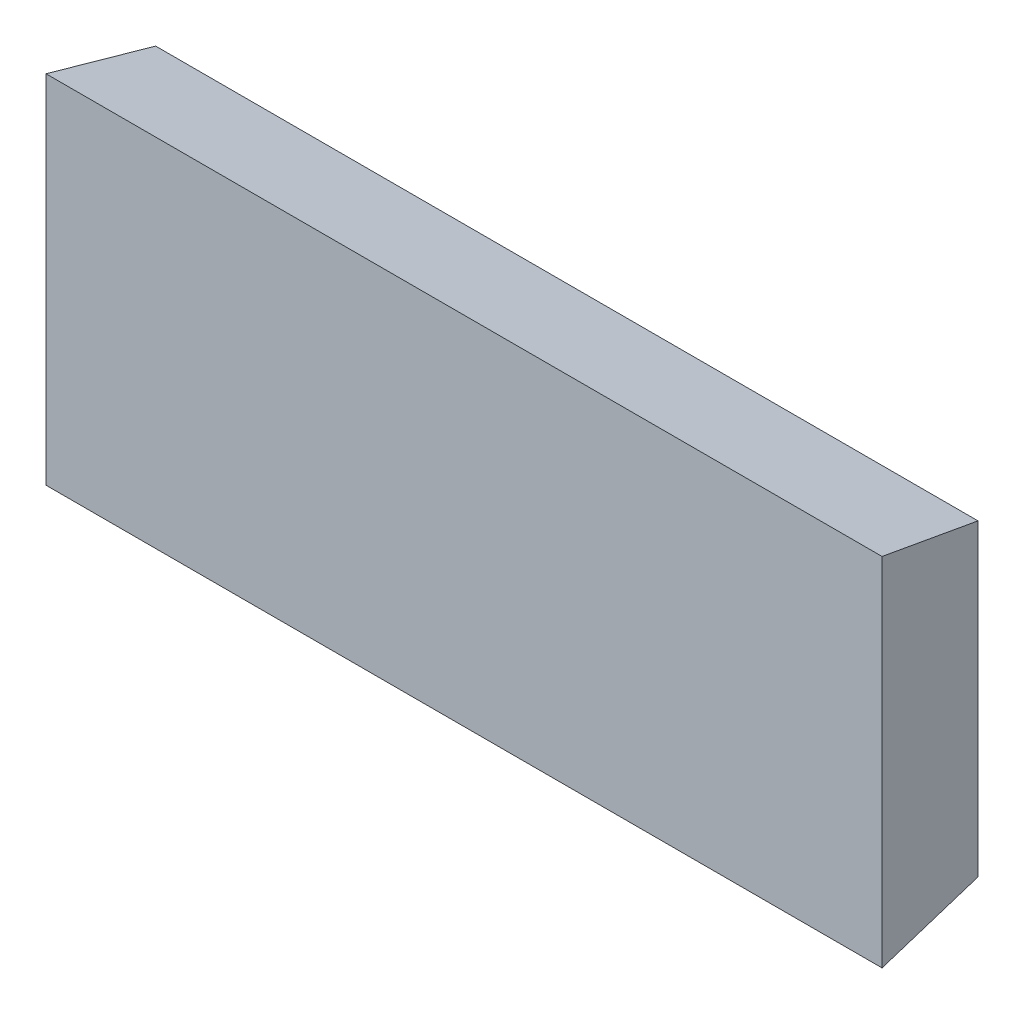
from build123d import *

# Parameters (mm, degrees)
BOSS_EXTRUDE1_DEPTH             = 80
BOSS_EXTRUDE2_REACH             = 88.865
BOSS_EXTRUDE2_DIRECTION_2_REACH = 88.865


with BuildPart() as part:
    # Sketch2 → Boss-Extrude1 (new body)
    with BuildSketch(Plane(origin=(0, 0, 0), x_dir=(0, 0, -1), z_dir=(1, 0, 0))):
        Polygon((0, 30), (-10, 32.333333333), (-10, -2.333333333), (0, 0), align=None)
    extrude(amount=BOSS_EXTRUDE1_DEPTH)

    # Boss-Extrude2: up to this face of the body (flat: up to its plane)
    boss_extrude2_end = Plane(part.part.faces().sort_by_distance((40, 31.166666667, 5))[0])
    # Sketch4 → Boss-Extrude2 (add, up to the picked face)
    with BuildSketch(Plane(origin=(0, 0, 0), x_dir=(1, 0, 0), z_dir=(0, 1, 0)), mode=Mode.PRIVATE) as boss_extrude2_sk1:
        Polygon((0, 0), (0, -10), (-0.666666667, -10), align=None)
    boss_extrude2_tool1 = split(extrude(boss_extrude2_sk1.sketch, amount=BOSS_EXTRUDE2_REACH, mode=Mode.PRIVATE), bisect_by=boss_extrude2_end, keep=Keep.BOTH, mode=Mode.PRIVATE)
    # Sketch4 → Boss-Extrude2 (add, up to the picked face)
    with BuildSketch(Plane(origin=(0, 0, 0), x_dir=(1, 0, 0), z_dir=(0, 1, 0)), mode=Mode.PRIVATE) as boss_extrude2_sk2:
        Polygon((80.666666667, -10), (80, 0), (80, -10), align=None)
    boss_extrude2_tool2 = split(extrude(boss_extrude2_sk2.sketch, amount=BOSS_EXTRUDE2_REACH, mode=Mode.PRIVATE), bisect_by=boss_extrude2_end, keep=Keep.BOTH, mode=Mode.PRIVATE)
    add(boss_extrude2_tool1.solids().sort_by(Axis((-0.222222, 0, 6.666667), (0, 1, 0)))[0])
    add(boss_extrude2_tool2.solids().sort_by(Axis((80.222222, 0, 6.666667), (0, 1, 0)))[0])

    # Boss-Extrude2 direction 2: up to this face of the body (flat: up to its plane)
    boss_extrude2_direction_2_end = Plane(part.part.faces().sort_by_distance((40, -1.166666667, 5))[0])
    # Sketch4 → Boss-Extrude2 direction 2 (add, up to the picked face)
    with BuildSketch(Plane(origin=(0, 0, 0), x_dir=(1, 0, 0), z_dir=(0, 1, 0)), mode=Mode.PRIVATE) as boss_extrude2_direction_2_sk1:
        Polygon((0, 0), (0, -10), (-0.666666667, -10), align=None)
    boss_extrude2_direction_2_tool1 = split(extrude(boss_extrude2_direction_2_sk1.sketch, amount=-BOSS_EXTRUDE2_DIRECTION_2_REACH, mode=Mode.PRIVATE), bisect_by=boss_extrude2_direction_2_end, keep=Keep.BOTH, mode=Mode.PRIVATE)
    # Sketch4 → Boss-Extrude2 direction 2 (add, up to the picked face)
    with BuildSketch(Plane(origin=(0, 0, 0), x_dir=(1, 0, 0), z_dir=(0, 1, 0)), mode=Mode.PRIVATE) as boss_extrude2_direction_2_sk2:
        Polygon((80.666666667, -10), (80, 0), (80, -10), align=None)
    boss_extrude2_direction_2_tool2 = split(extrude(boss_extrude2_direction_2_sk2.sketch, amount=-BOSS_EXTRUDE2_DIRECTION_2_REACH, mode=Mode.PRIVATE), bisect_by=boss_extrude2_direction_2_end, keep=Keep.BOTH, mode=Mode.PRIVATE)
    add(boss_extrude2_direction_2_tool1.solids().sort_by(Axis((-0.222222, 0, 6.666667), (0, -1, 0)))[0])
    add(boss_extrude2_direction_2_tool2.solids().sort_by(Axis((80.222222, 0, 6.666667), (0, -1, 0)))[0])


solid = part.part
